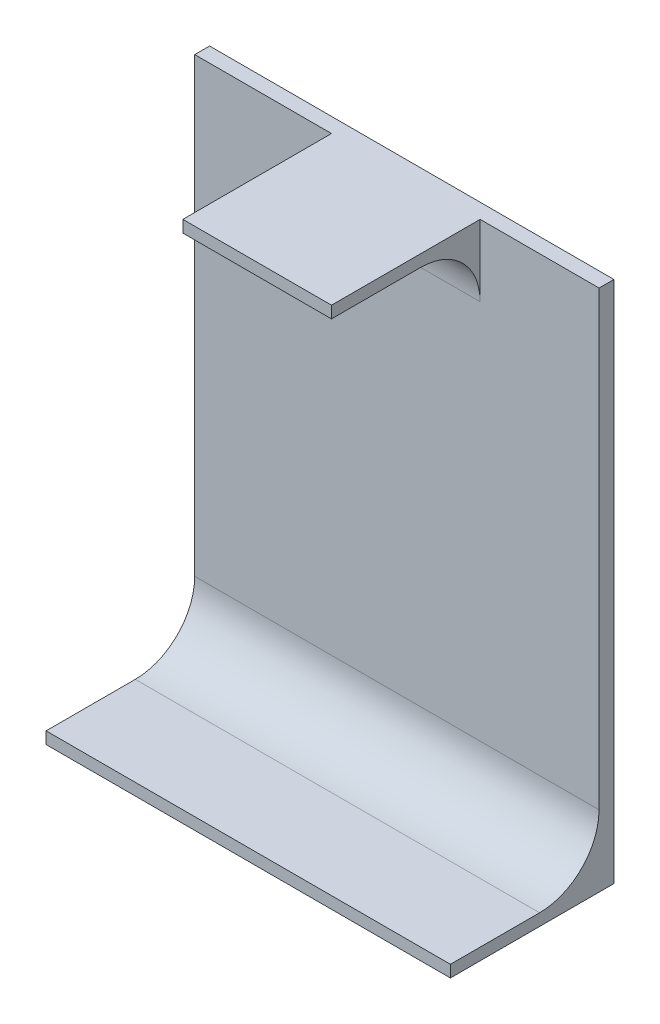
from build123d import *

# Parameters (mm, degrees)
BOSS_EXTRUDE1_DEPTH      = 25
BOSS_EXTRUDE1_DEPTH_BACK = 2.5
SKETCH1_W                = 68
SKETCH1_H                = 88
SKETCH2_W                = 82.510400987
SKETCH2_H                = 84
CUT_EXTRUDE1_DEPTH       = 25
SKETCH3_W                = 23
SKETCH3_H                = 25
CUT_EXTRUDE2_DEPTH       = 25
SKETCH4_W                = 20
SKETCH4_H                = 25
CUT_EXTRUDE3_DEPTH       = 25
FILLET2_R                = 10


with BuildPart() as part:
    # Sketch1 → Boss-Extrude1 (new, two sides: drawn at the far end of the back side and taken through both)
    with BuildSketch(Plane.XY.offset(-BOSS_EXTRUDE1_DEPTH_BACK)):
        with Locations((-34, -44)):
            Rectangle(SKETCH1_W, SKETCH1_H)
    extrude(amount=BOSS_EXTRUDE1_DEPTH + BOSS_EXTRUDE1_DEPTH_BACK)

    # Sketch2 → Cut-Extrude1 (cut)
    with BuildSketch(Plane.XY.offset(25)):
        with Locations((-33.923509309, -44)):
            Rectangle(SKETCH2_W, SKETCH2_H)
    extrude(amount=-CUT_EXTRUDE1_DEPTH, mode=Mode.SUBTRACT)

    # Sketch3 → Cut-Extrude2 (cut)
    with BuildSketch(Plane(origin=(0, 0, 0), x_dir=(1, 0, 0), z_dir=(0, 1, 0))):
        with Locations((-56.5, -12.5)):
            Rectangle(SKETCH3_W, SKETCH3_H)
    extrude(amount=-CUT_EXTRUDE2_DEPTH, mode=Mode.SUBTRACT)

    # Sketch4 → Cut-Extrude3 (cut)
    with BuildSketch(Plane(origin=(0, 0, 0), x_dir=(1, 0, 0), z_dir=(0, 1, 0))):
        with Locations((-10, -12.5)):
            Rectangle(SKETCH4_W, SKETCH4_H)
    extrude(amount=-CUT_EXTRUDE3_DEPTH, mode=Mode.SUBTRACT)

    # Fillet2
    fillet2_edges = [part.edges().sort_by_distance(p)[0] for p in [
        (-34, -86, 0),
        (-32.5, -2, 0),
    ]]
    fillet(fillet2_edges, radius=FILLET2_R)


solid = part.part
